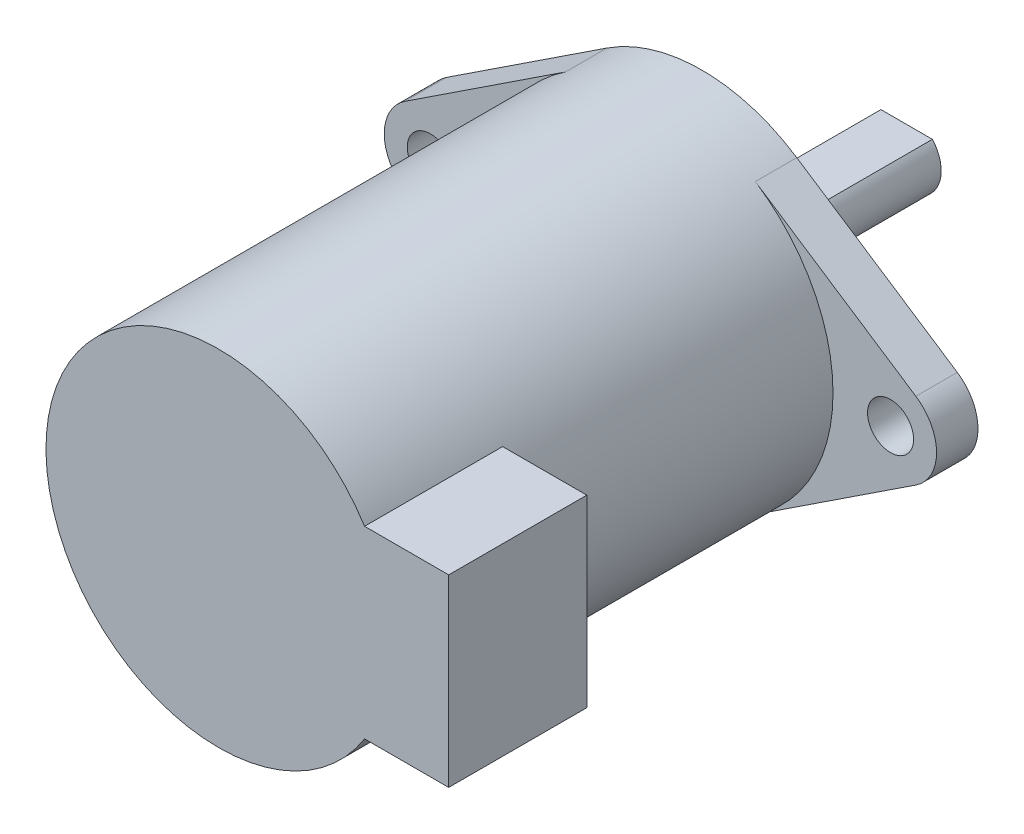
from build123d import *

# Parameters (mm, degrees)
SKETCH_2_R          = 7.5
EXTRUDE_2_DEPTH     = 21
SKETCH_3_R          = 3
EXTRUDE_3_DEPTH     = 2
SKETCH_4_R          = 1.5
EXTRUDE_4_DEPTH     = 6.9
CUT_EXTRUDE_START   = -6.5
CUT_EXTRUDE_1_DEPTH = 6.5
SKETCH_6_R          = 1
EXTRUDE_6_DEPTH     = 1.8
SKETCH_7_W          = 6
SKETCH_7_H          = 8
EXTRUDE_7_DEPTH     = 10


with BuildPart() as part:
    # 草图2 → 凸台-拉伸2 (new body)
    with BuildSketch(Plane.XY):
        with Locations(Location((0, 0, 0), (0, 0, 180))):
            Circle(SKETCH_2_R)
    extrude(amount=EXTRUDE_2_DEPTH)

    # 草图3 → 凸台-拉伸3 (add)
    with BuildSketch(Plane(origin=(0, 0, 0), x_dir=(-1, 0, 0), z_dir=(0, 0, -1))):
        Circle(SKETCH_3_R)
    extrude(amount=EXTRUDE_3_DEPTH)

    # 草图4 → 凸台-拉伸4 (add)
    with BuildSketch(Plane(origin=(0, 0, -2), x_dir=(-1, 0, 0), z_dir=(0, 0, -1))):
        with Locations(Location((0, 0, 0), (0, 0, 180))):
            Circle(SKETCH_4_R)
    extrude(amount=EXTRUDE_4_DEPTH)

    # 草图5 → 切除-拉伸1 (cut)
    with BuildSketch(Plane(origin=(0, 0, -8.9), x_dir=(-1, 0, 0), z_dir=(0, 0, -1)).offset(CUT_EXTRUDE_START)):
        with BuildLine():
            Line((-1.118033989, 1), (1.118033989, 1))
            ThreePointArc((1.118033989, 1), (0, 1.5), (-1.118033989, 1))
        make_face()
    extrude(amount=CUT_EXTRUDE_1_DEPTH, mode=Mode.SUBTRACT)

    # 草图6 → 凸台-拉伸6 (add)
    with BuildSketch(Plane(origin=(0, 0, 0), x_dir=(-1, 0, 0), z_dir=(0, 0, -1))):
        with BuildLine():
            Line((11.1, 1.670329309), (4.125, 6.263734908))
            ThreePointArc((4.125, 6.263734908), (0, 7.5), (-4.125, 6.263734908))
            Line((-4.125, 6.263734908), (-11.1, 1.670329309))
            ThreePointArc((-11.1, 1.670329309), (-12, 0), (-11.1, -1.670329309))
            Line((-11.1, -1.670329309), (-4.125, -6.263734908))
            ThreePointArc((-4.125, -6.263734908), (0, -7.5), (4.125, -6.263734908))
            Line((4.125, -6.263734908), (11.1, -1.670329309))
            ThreePointArc((11.1, -1.670329309), (12, 0), (11.1, 1.670329309))
        make_face()
        with Locations((10, 0)):
            Circle(SKETCH_6_R, mode=Mode.SUBTRACT)
        with Locations(Location((-10, 0, 0), (0, 0, 180))):
            Circle(SKETCH_6_R, mode=Mode.SUBTRACT)
    extrude(amount=-EXTRUDE_6_DEPTH)

    # 草图7 → 凸台-拉伸7 (add)
    with BuildSketch(Plane(origin=(0, 0, 0), x_dir=(0, 0, -1), z_dir=(1, 0, 0))):
        with Locations((-18, 0)):
            Rectangle(SKETCH_7_W, SKETCH_7_H)
    extrude(amount=EXTRUDE_7_DEPTH)


solid = part.part
